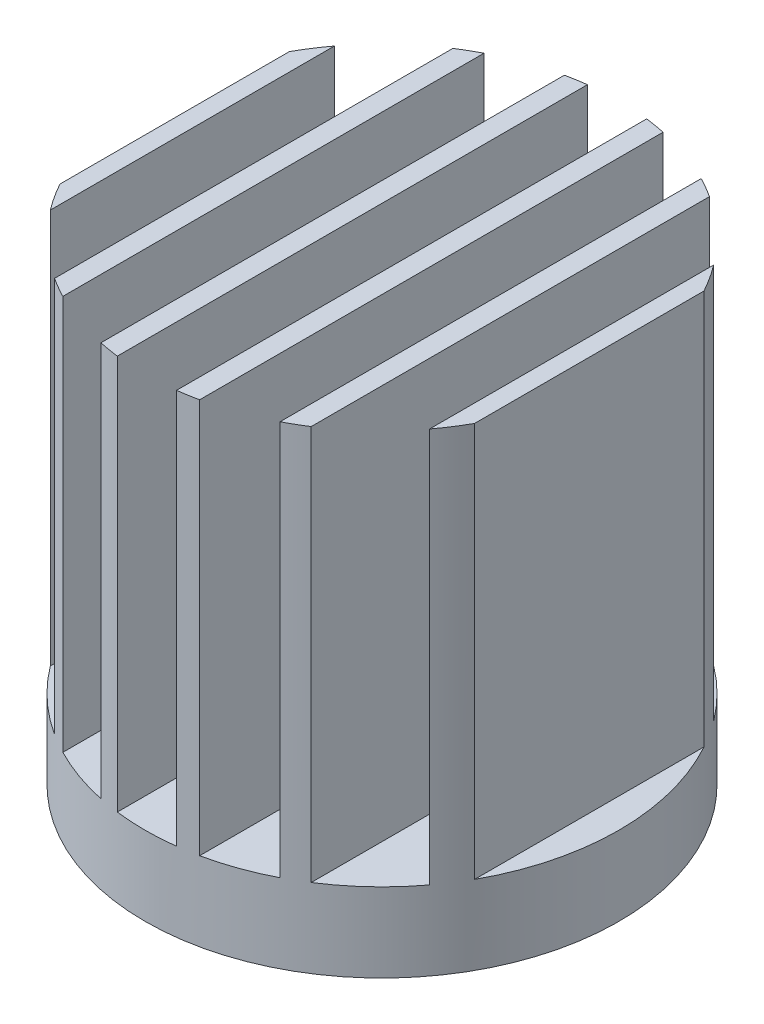
from build123d import *

# Parameters (mm, degrees)
SKETCH2_R           = 60
BOSS_EXTRUDE1_DEPTH = 120
SKETCH4_W           = 7.5
SKETCH4_H           = 100
SKETCH4_W_2         = 15.517169794
SKETCH4_W_3         = 15
CUT_EXTRUDE1_DEPTH  = 60


with BuildPart() as part:
    # Sketch2 → Boss-Extrude1 (new body)
    with BuildSketch(Plane(origin=(0, 0, 0), x_dir=(1, 0, 0), z_dir=(0, 1, 0))):
        with Locations(Location((0, 0, 0), (0, 0, 270))):
            Circle(SKETCH2_R)
    extrude(amount=BOSS_EXTRUDE1_DEPTH)

    # Sketch4 → Cut-Extrude1 (cut, symmetric)
    with BuildSketch(Plane.XY):
        with Locations((-56.25, 70)):
            Rectangle(SKETCH4_W, SKETCH4_H)
        with Locations((-40.258584897, 70)):
            Rectangle(SKETCH4_W_2, SKETCH4_H)
        with Locations((-20, 70)):
            Rectangle(SKETCH4_W_3, SKETCH4_H)
        with Locations((0, 70)):
            Rectangle(SKETCH4_W_3, SKETCH4_H)
        with Locations((20, 70)):
            Rectangle(SKETCH4_W_3, SKETCH4_H)
        with Locations((40.258584897, 70)):
            Rectangle(SKETCH4_W_2, SKETCH4_H)
        with Locations((56.25, 70)):
            Rectangle(SKETCH4_W, SKETCH4_H)
    extrude(amount=CUT_EXTRUDE1_DEPTH, both=True, mode=Mode.SUBTRACT)


solid = part.part
